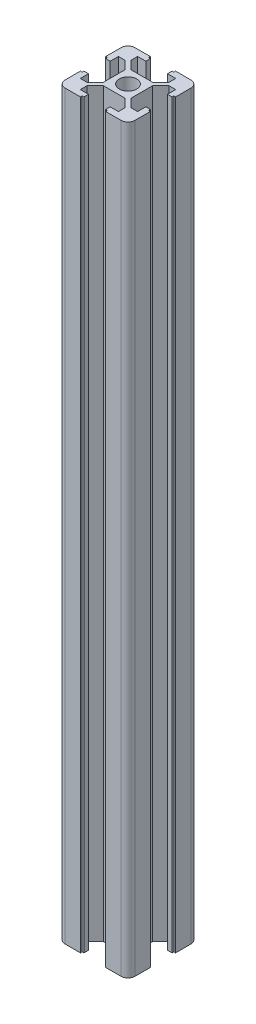
from build123d import *

# Parameters (mm, degrees)
SKETCH_1_R      = 2.5
EXTRUDE_1_DEPTH = 212.04


with BuildPart() as part:
    # 草图1 → 凸台-拉伸1 (new body)
    with BuildSketch(Plane(origin=(0, 0, 0), x_dir=(1, 0, 0), z_dir=(0, 1, 0))):
        with BuildLine():
            Line((-3.948528137, -3.1), (-6.298528137, -5.45))
            Line((-6.298528137, -5.45), (-8.2, -5.45))
            Line((-8.2, -5.45), (-8.2, -3.1))
            Line((-8.2, -3.1), (-9.5, -3.1))
            Line((-9.5, -3.1), (-9.5, -3.6))
            Line((-9.5, -3.6), (-10, -3.6))
            Line((-10, -3.6), (-10, -8))
            ThreePointArc((-10, -8), (-9.414213562, -9.414213562), (-8, -10))
            Line((-8, -10), (-3.6, -10))
            Line((-3.6, -10), (-3.6, -9.5))
            Line((-3.6, -9.5), (-3.1, -9.5))
            Line((-3.1, -9.5), (-3.1, -8.2))
            Line((-3.1, -8.2), (-5.45, -8.2))
            Line((-5.45, -8.2), (-5.45, -6.298528137))
            Line((-5.45, -6.298528137), (-3.1, -3.948528137))
            Line((-3.1, -3.948528137), (0, -3.948528137))
            Line((0, -3.948528137), (3.1, -3.948528137))
            Line((3.1, -3.948528137), (5.45, -6.298528137))
            Line((5.45, -6.298528137), (5.45, -8.2))
            Line((5.45, -8.2), (3.1, -8.2))
            Line((3.1, -8.2), (3.1, -9.5))
            Line((3.1, -9.5), (3.6, -9.5))
            Line((3.6, -9.5), (3.6, -10))
            Line((3.6, -10), (8, -10))
            ThreePointArc((8, -10), (9.414213562, -9.414213562), (10, -8))
            Line((10, -8), (10, -3.6))
            Line((10, -3.6), (9.5, -3.6))
            Line((9.5, -3.6), (9.5, -3.1))
            Line((9.5, -3.1), (8.2, -3.1))
            Line((8.2, -3.1), (8.2, -5.45))
            Line((8.2, -5.45), (6.298528137, -5.45))
            Line((6.298528137, -5.45), (3.948528137, -3.1))
            Line((3.948528137, -3.1), (3.948528137, 0))
            Line((3.948528137, 0), (3.948528137, 3.1))
            Line((3.948528137, 3.1), (6.298528137, 5.45))
            Line((6.298528137, 5.45), (8.2, 5.45))
            Line((8.2, 5.45), (8.2, 3.1))
            Line((8.2, 3.1), (9.5, 3.1))
            Line((9.5, 3.1), (9.5, 3.6))
            Line((9.5, 3.6), (10, 3.6))
            Line((10, 3.6), (10, 8))
            ThreePointArc((10, 8), (9.414213562, 9.414213562), (8, 10))
            Line((8, 10), (3.6, 10))
            Line((3.6, 10), (3.6, 9.5))
            Line((3.6, 9.5), (3.1, 9.5))
            Line((3.1, 9.5), (3.1, 8.2))
            Line((3.1, 8.2), (5.45, 8.2))
            Line((5.45, 8.2), (5.45, 6.298528137))
            Line((5.45, 6.298528137), (3.1, 3.948528137))
            Line((3.1, 3.948528137), (0, 3.948528137))
            Line((0, 3.948528137), (-3.1, 3.948528137))
            Line((-3.1, 3.948528137), (-5.45, 6.298528137))
            Line((-5.45, 6.298528137), (-5.45, 8.2))
            Line((-5.45, 8.2), (-3.1, 8.2))
            Line((-3.1, 8.2), (-3.1, 9.5))
            Line((-3.1, 9.5), (-3.6, 9.5))
            Line((-3.6, 9.5), (-3.6, 10))
            Line((-3.6, 10), (-8, 10))
            ThreePointArc((-8, 10), (-9.414213562, 9.414213562), (-10, 8))
            Line((-10, 8), (-10, 3.6))
            Line((-10, 3.6), (-9.5, 3.6))
            Line((-9.5, 3.6), (-9.5, 3.1))
            Line((-9.5, 3.1), (-8.2, 3.1))
            Line((-8.2, 3.1), (-8.2, 5.45))
            Line((-8.2, 5.45), (-6.298528137, 5.45))
            Line((-6.298528137, 5.45), (-3.948528137, 3.1))
            Line((-3.948528137, 3.1), (-3.948528137, 0))
            Line((-3.948528137, 0), (-3.948528137, -3.1))
        make_face()
        with Locations(Location((0, 0, 0), (0, 0, 270))):
            Circle(SKETCH_1_R, mode=Mode.SUBTRACT)
    extrude(amount=EXTRUDE_1_DEPTH)


solid = part.part
